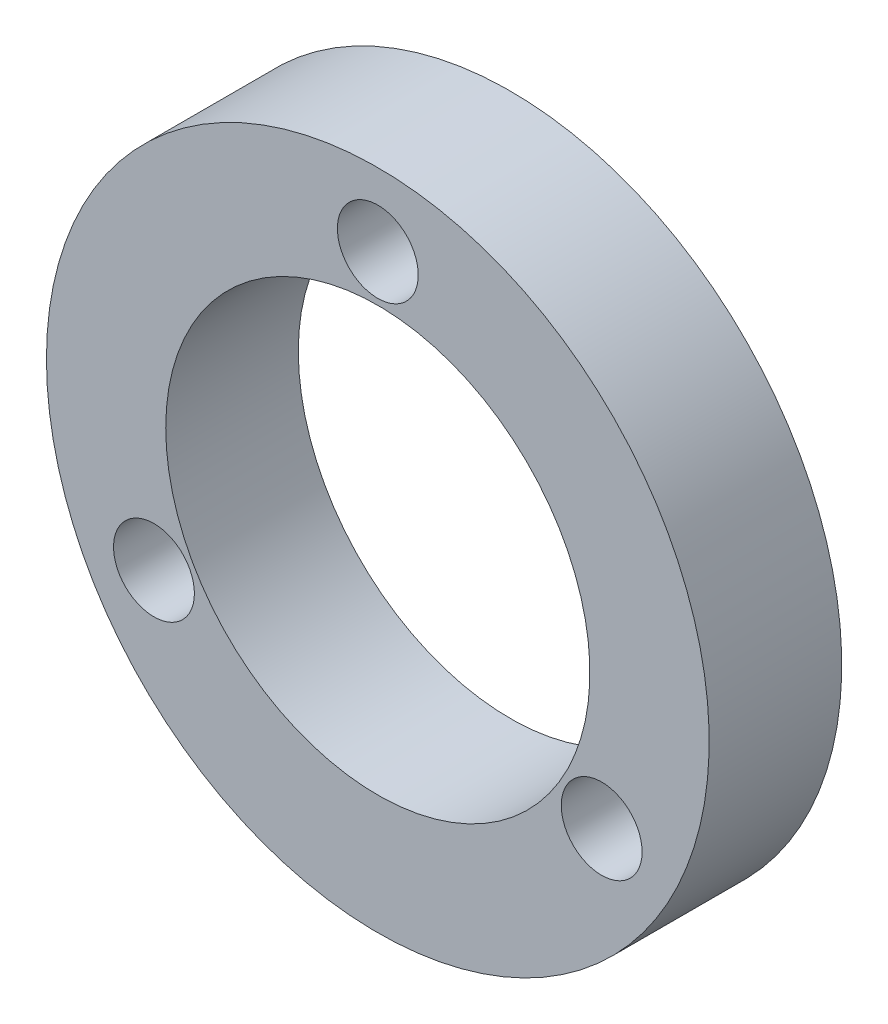
from build123d import *

# Parameters (mm, degrees)
SKETCH1_R           = 12.5
SKETCH1_R_2         = 8
BOSS_EXTRUDE1_DEPTH = 5
CUT_EXTRUDE1_REACH  = 20.371
SKETCH2_R           = 1.525


with BuildPart() as part:
    # Sketch1 → Boss-Extrude1 (new body)
    with BuildSketch(Plane.XY):
        Circle(SKETCH1_R)
        Circle(SKETCH1_R_2, mode=Mode.SUBTRACT)
    extrude(amount=BOSS_EXTRUDE1_DEPTH)

    # Sketch2 → Cut-Extrude1 (cut, up to next)
    with BuildSketch(Plane.XY.offset(5), mode=Mode.PRIVATE) as cut_extrude1_sk1:
        with Locations((0, 9.75)):
            Circle(SKETCH2_R)
    cut_extrude1_tool1 = extrude(cut_extrude1_sk1.sketch, amount=-CUT_EXTRUDE1_REACH, mode=Mode.PRIVATE) & part.part
    # Sketch2 → Cut-Extrude1 (cut, up to next)
    with BuildSketch(Plane.XY.offset(5), mode=Mode.PRIVATE) as cut_extrude1_sk2:
        with Locations((8.443747687, -4.875)):
            Circle(SKETCH2_R)
    cut_extrude1_tool2 = extrude(cut_extrude1_sk2.sketch, amount=-CUT_EXTRUDE1_REACH, mode=Mode.PRIVATE) & part.part
    # Sketch2 → Cut-Extrude1 (cut, up to next)
    with BuildSketch(Plane.XY.offset(5), mode=Mode.PRIVATE) as cut_extrude1_sk3:
        with Locations((-8.443747687, -4.875)):
            Circle(SKETCH2_R)
    cut_extrude1_tool3 = extrude(cut_extrude1_sk3.sketch, amount=-CUT_EXTRUDE1_REACH, mode=Mode.PRIVATE) & part.part
    add(cut_extrude1_tool1.solids().sort_by_distance((0, 9.75, 5))[0], mode=Mode.SUBTRACT)
    add(cut_extrude1_tool2.solids().sort_by_distance((8.443748, -4.875, 5))[0], mode=Mode.SUBTRACT)
    add(cut_extrude1_tool3.solids().sort_by_distance((-8.443748, -4.875, 5))[0], mode=Mode.SUBTRACT)


solid = part.part
